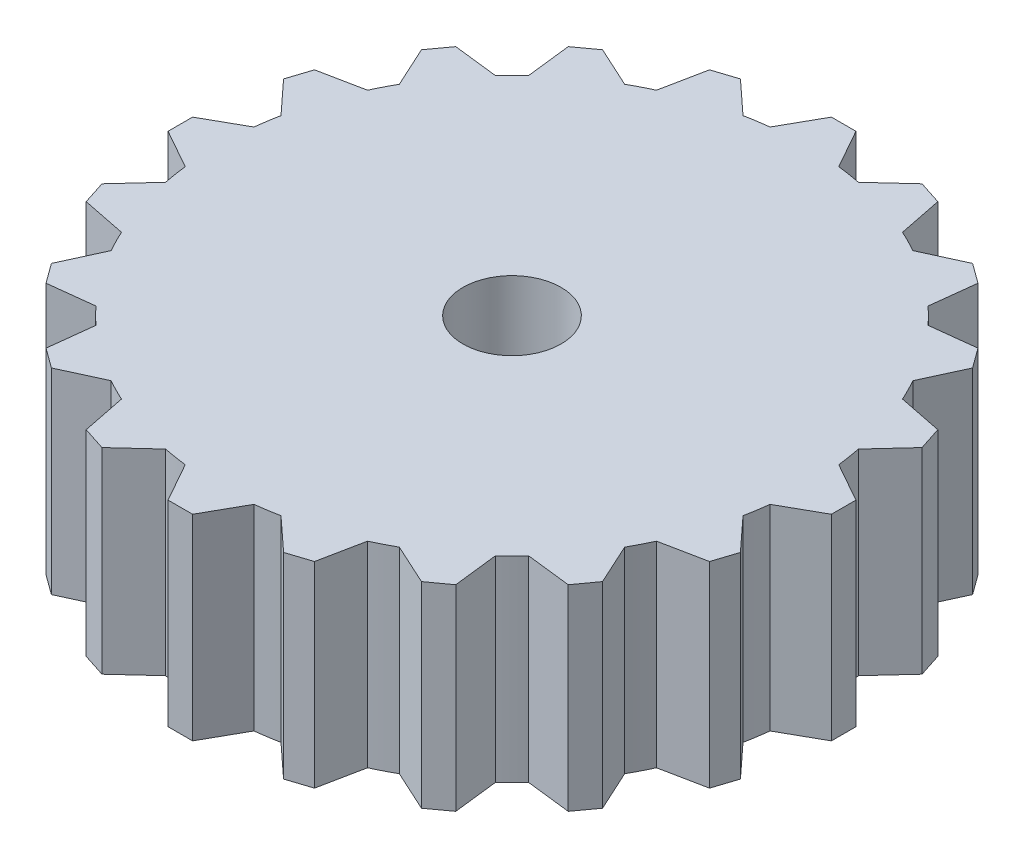
from build123d import *

# Parameters (mm, degrees)
BOSS_EXTRUDE2_DEPTH = 10
SKETCH3_R           = 10
CUT_EXTRUDE1_DEPTH  = 2.2
SKETCH4_R           = 2.5
CUT_EXTRUDE2_DEPTH  = 26.137532403


with BuildPart() as part:
    # Sketch2 → Boss-Extrude2 (new body)
    with BuildSketch(Plane(origin=(0, 0, 0), x_dir=(1, 0, 0), z_dir=(0, 1, 0))):
        with BuildLine():
            Line((-0.625, 16.897566915), (0.625, 16.897566915))
            Line((0.625, 16.897566915), (1.75, 14.897566915))
            ThreePointArc((1.75, 14.897566915), (2.346516976, 14.815325109), (2.939252448, 14.709207832))
            Line((2.939252448, 14.709207832), (4.627225018, 16.263676746))
            Line((4.627225018, 16.263676746), (5.816045663, 15.877405503))
            Line((5.816045663, 15.877405503), (6.267950255, 13.627648352))
            ThreePointArc((6.267950255, 13.627648352), (6.809857496, 13.365097863), (7.340790388, 13.081009001))
            Line((7.340790388, 13.081009001), (9.426505011, 14.037784581))
            Line((9.426505011, 14.037784581), (10.437776254, 13.303053015))
            Line((10.437776254, 13.303053015), (10.172349868, 11.023760618))
            ThreePointArc((10.172349868, 11.023760618), (10.606601718, 10.606601718), (11.023760618, 10.172349868))
            Line((11.023760618, 10.172349868), (13.303053015, 10.437776254))
            Line((13.303053015, 10.437776254), (14.037784581, 9.426505011))
            Line((14.037784581, 9.426505011), (13.081009001, 7.340790388))
            ThreePointArc((13.081009001, 7.340790388), (13.365097863, 6.809857496), (13.627648352, 6.267950255))
            Line((13.627648352, 6.267950255), (15.877405503, 5.816045663))
            Line((15.877405503, 5.816045663), (16.263676746, 4.627225018))
            Line((16.263676746, 4.627225018), (14.709207832, 2.939252448))
            ThreePointArc((14.709207832, 2.939252448), (14.815325109, 2.346516976), (14.897566915, 1.75))
            Line((14.897566915, 1.75), (16.897566915, 0.625))
            Line((16.897566915, 0.625), (16.897566915, -0.625))
            Line((16.897566915, -0.625), (14.897566915, -1.75))
            ThreePointArc((14.897566915, -1.75), (14.815325109, -2.346516976), (14.709207832, -2.939252448))
            Line((14.709207832, -2.939252448), (16.263676746, -4.627225018))
            Line((16.263676746, -4.627225018), (15.877405503, -5.816045663))
            Line((15.877405503, -5.816045663), (13.627648352, -6.267950255))
            ThreePointArc((13.627648352, -6.267950255), (13.365097863, -6.809857496), (13.081009001, -7.340790388))
            Line((13.081009001, -7.340790388), (14.037784581, -9.426505011))
            Line((14.037784581, -9.426505011), (13.303053015, -10.437776254))
            Line((13.303053015, -10.437776254), (11.023760618, -10.172349868))
            ThreePointArc((11.023760618, -10.172349868), (10.606601718, -10.606601718), (10.172349868, -11.023760618))
            Line((10.172349868, -11.023760618), (10.437776254, -13.303053015))
            Line((10.437776254, -13.303053015), (9.426505011, -14.037784581))
            Line((9.426505011, -14.037784581), (7.340790388, -13.081009001))
            ThreePointArc((7.340790388, -13.081009001), (6.809857496, -13.365097863), (6.267950255, -13.627648352))
            Line((6.267950255, -13.627648352), (5.816045663, -15.877405503))
            Line((5.816045663, -15.877405503), (4.627225018, -16.263676746))
            Line((4.627225018, -16.263676746), (2.939252448, -14.709207832))
            ThreePointArc((2.939252448, -14.709207832), (2.346516976, -14.815325109), (1.75, -14.897566915))
            Line((1.75, -14.897566915), (0.625, -16.897566915))
            Line((0.625, -16.897566915), (-0.625, -16.897566915))
            Line((-0.625, -16.897566915), (-1.75, -14.897566915))
            ThreePointArc((-1.75, -14.897566915), (-2.346516976, -14.815325109), (-2.939252448, -14.709207832))
            Line((-2.939252448, -14.709207832), (-4.627225018, -16.263676746))
            Line((-4.627225018, -16.263676746), (-5.816045663, -15.877405503))
            Line((-5.816045663, -15.877405503), (-6.267950255, -13.627648352))
            ThreePointArc((-6.267950255, -13.627648352), (-6.809857496, -13.365097863), (-7.340790388, -13.081009001))
            Line((-7.340790388, -13.081009001), (-9.426505011, -14.037784581))
            Line((-9.426505011, -14.037784581), (-10.437776254, -13.303053015))
            Line((-10.437776254, -13.303053015), (-10.172349868, -11.023760618))
            ThreePointArc((-10.172349868, -11.023760618), (-10.606601718, -10.606601718), (-11.023760618, -10.172349868))
            Line((-11.023760618, -10.172349868), (-13.303053015, -10.437776254))
            Line((-13.303053015, -10.437776254), (-14.037784581, -9.426505011))
            Line((-14.037784581, -9.426505011), (-13.081009001, -7.340790388))
            ThreePointArc((-13.081009001, -7.340790388), (-13.365097863, -6.809857496), (-13.627648352, -6.267950255))
            Line((-13.627648352, -6.267950255), (-15.877405503, -5.816045663))
            Line((-15.877405503, -5.816045663), (-16.263676746, -4.627225018))
            Line((-16.263676746, -4.627225018), (-14.709207832, -2.939252448))
            ThreePointArc((-14.709207832, -2.939252448), (-14.815325109, -2.346516976), (-14.897566915, -1.75))
            Line((-14.897566915, -1.75), (-16.897566915, -0.625))
            Line((-16.897566915, -0.625), (-16.897566915, 0.625))
            Line((-16.897566915, 0.625), (-14.897566915, 1.75))
            ThreePointArc((-14.897566915, 1.75), (-14.815325109, 2.346516976), (-14.709207832, 2.939252448))
            Line((-14.709207832, 2.939252448), (-16.263676746, 4.627225018))
            Line((-16.263676746, 4.627225018), (-15.877405503, 5.816045663))
            Line((-15.877405503, 5.816045663), (-13.627648352, 6.267950255))
            ThreePointArc((-13.627648352, 6.267950255), (-13.365097863, 6.809857496), (-13.081009001, 7.340790388))
            Line((-13.081009001, 7.340790388), (-14.037784581, 9.426505011))
            Line((-14.037784581, 9.426505011), (-13.303053015, 10.437776254))
            Line((-13.303053015, 10.437776254), (-11.023760618, 10.172349868))
            ThreePointArc((-11.023760618, 10.172349868), (-10.606601718, 10.606601718), (-10.172349868, 11.023760618))
            Line((-10.172349868, 11.023760618), (-10.437776254, 13.303053015))
            Line((-10.437776254, 13.303053015), (-9.426505011, 14.037784581))
            Line((-9.426505011, 14.037784581), (-7.340790388, 13.081009001))
            ThreePointArc((-7.340790388, 13.081009001), (-6.809857496, 13.365097863), (-6.267950255, 13.627648352))
            Line((-6.267950255, 13.627648352), (-5.816045663, 15.877405503))
            Line((-5.816045663, 15.877405503), (-4.627225018, 16.263676746))
            Line((-4.627225018, 16.263676746), (-2.939252448, 14.709207832))
            ThreePointArc((-2.939252448, 14.709207832), (-2.346516976, 14.815325109), (-1.75, 14.897566915))
            Line((-1.75, 14.897566915), (-0.625, 16.897566915))
        make_face()
    extrude(amount=BOSS_EXTRUDE2_DEPTH)

    # Sketch3 → Cut-Extrude1 (cut)
    with BuildSketch(Plane.XZ):
        with Locations(Location((0, 0, 0), (0, 0, 270))):
            Circle(SKETCH3_R)
    extrude(amount=-CUT_EXTRUDE1_DEPTH, mode=Mode.SUBTRACT)

    # Sketch4 → Cut-Extrude2 (cut, through all)
    with BuildSketch(Plane.XZ.offset(-2.2)):
        with Locations(Location((0, 0, 0), (0, 0, 270))):
            Circle(SKETCH4_R)
    extrude(amount=-CUT_EXTRUDE2_DEPTH, mode=Mode.SUBTRACT)


solid = part.part
